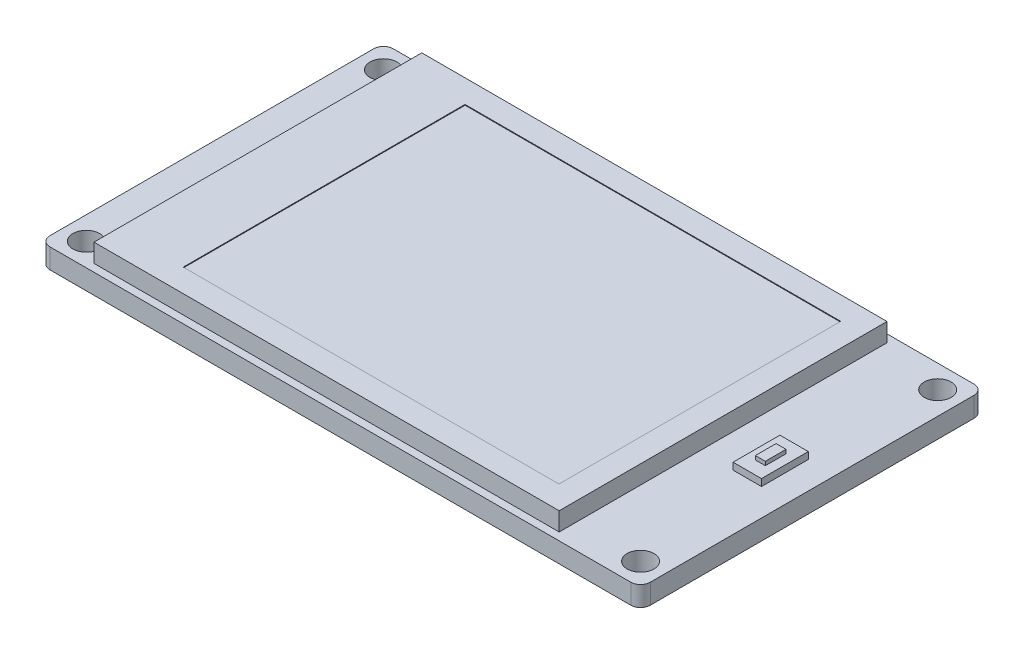
from build123d import *

# Parameters (mm, degrees)
SKETCH_1_R          = 1.75
EXTRUDE_1_DEPTH     = 1.6
SKETCH_1_3_W        = 60.62
SKETCH_1_3_H        = 42.72
SKETCH_1_3_W_2      = 48.96
SKETCH_1_3_H_2      = 36.72
EXTRUDE_2_DEPTH     = 5
EXTRUDE_START       = 1.6
SKETCH_1_4_R        = 1.75
SKETCH_1_4_W        = 60.62
SKETCH_1_4_H        = 42.72
SKETCH_1_4_W_2      = 1.3
SKETCH_1_4_H_2      = 2.7
EXTRUDE_3_DEPTH     = 1
CUT_EXTRUDE_START   = 5
SKETCH_1_5_W        = 48.96
SKETCH_1_5_H        = 36.72
CUT_EXTRUDE_1_DEPTH = 0.1
SKETCH_1_6_W        = 3.7
SKETCH_1_6_H        = 6.1
SKETCH_1_6_W_2      = 1.3
SKETCH_1_6_H_2      = 2.7
EXTRUDE_4_DEPTH     = 3.5
SKETCH_1_7_W        = 1.3
SKETCH_1_7_H        = 2.7
EXTRUDE_5_DEPTH     = 4
SKETCH_2_W          = 0.5
SKETCH_2_H          = 26.5
EXTRUDE_6_DEPTH     = 2


with BuildPart() as part:
    # 草图1 → 凸台-拉伸1 (new body)
    with BuildSketch(Plane(origin=(0, 0, 0), x_dir=(1, 0, 0), z_dir=(0, 1, 0))):
        with BuildLine():
            Line((-37.84, 22.36), (37.84, 22.36))
            ThreePointArc((37.84, 22.36), (38.738025612, 21.988025612), (39.11, 21.09))
            Line((39.11, 21.09), (39.11, -21.09))
            ThreePointArc((39.11, -21.09), (38.738025612, -21.988025612), (37.84, -22.36))
            Line((37.84, -22.36), (-37.84, -22.36))
            ThreePointArc((-37.84, -22.36), (-38.738025612, -21.988025612), (-39.11, -21.09))
            Line((-39.11, -21.09), (-39.11, 21.09))
            ThreePointArc((-39.11, 21.09), (-38.738025612, 21.988025612), (-37.84, 22.36))
        make_face()
        with Locations(Location((-36.11, -19.36, 0), (0, 0, 270))):
            Circle(SKETCH_1_R, mode=Mode.SUBTRACT)
        with Locations(Location((36.11, -19.36, 0), (0, 0, 270))):
            Circle(SKETCH_1_R, mode=Mode.SUBTRACT)
        with Locations(Location((-36.11, 19.36, 0), (0, 0, 270))):
            Circle(SKETCH_1_R, mode=Mode.SUBTRACT)
        with Locations(Location((36.11, 19.36, 0), (0, 0, 270))):
            Circle(SKETCH_1_R, mode=Mode.SUBTRACT)
    extrude(amount=EXTRUDE_1_DEPTH)

    # 草图1<3> → 凸台-拉伸2 (add)
    with BuildSketch(Plane(origin=(0, 0, 0), x_dir=(1, 0, 0), z_dir=(0, 1, 0))):
        with Locations((-2.8, 0)):
            Rectangle(SKETCH_1_3_W, SKETCH_1_3_H)
        Rectangle(SKETCH_1_3_W_2, SKETCH_1_3_H_2)
    extrude(amount=EXTRUDE_2_DEPTH)

    # 草图1<4> → 凸台-拉伸3 (add)
    with BuildSketch(Plane(origin=(0, 0, 0), x_dir=(1, 0, 0), z_dir=(0, 1, 0)).offset(EXTRUDE_START)):
        with BuildLine():
            Line((37.84, 22.36), (-37.84, 22.36))
            ThreePointArc((-37.84, 22.36), (-38.738025612, 21.988025612), (-39.11, 21.09))
            Line((-39.11, 21.09), (-39.11, -21.09))
            ThreePointArc((-39.11, -21.09), (-38.738025612, -21.988025612), (-37.84, -22.36))
            Line((-37.84, -22.36), (37.84, -22.36))
            ThreePointArc((37.84, -22.36), (38.738025612, -21.988025612), (39.11, -21.09))
            Line((39.11, -21.09), (39.11, 21.09))
            ThreePointArc((39.11, 21.09), (38.738025612, 21.988025612), (37.84, 22.36))
        make_face()
        with Locations(Location((-36.11, -19.36, 0), (0, 0, 270))):
            Circle(SKETCH_1_4_R, mode=Mode.SUBTRACT)
        with Locations(Location((36.11, -19.36, 0), (0, 0, 270))):
            Circle(SKETCH_1_4_R, mode=Mode.SUBTRACT)
        with Locations((-2.8, 0)):
            Rectangle(SKETCH_1_4_W, SKETCH_1_4_H, mode=Mode.SUBTRACT)
        with Locations(Location((-36.11, 19.36, 0), (0, 0, 270))):
            Circle(SKETCH_1_4_R, mode=Mode.SUBTRACT)
        with Locations(Location((36.11, 19.36, 0), (0, 0, 270))):
            Circle(SKETCH_1_4_R, mode=Mode.SUBTRACT)
        with Locations((33.71, 0)):
            Rectangle(SKETCH_1_4_W_2, SKETCH_1_4_H_2, mode=Mode.SUBTRACT)
    extrude(amount=EXTRUDE_3_DEPTH)

    # 草图1<5> → 切除-拉伸1 (cut)
    with BuildSketch(Plane(origin=(0, 0, 0), x_dir=(1, 0, 0), z_dir=(0, 1, 0)).offset(CUT_EXTRUDE_START)):
        Rectangle(SKETCH_1_5_W, SKETCH_1_5_H)
    extrude(amount=-CUT_EXTRUDE_1_DEPTH, mode=Mode.SUBTRACT)

    # 草图1<6> → 凸台-拉伸4 (add)
    with BuildSketch(Plane(origin=(0, 0, 0), x_dir=(1, 0, 0), z_dir=(0, 1, 0))):
        with Locations((33.71, 0)):
            Rectangle(SKETCH_1_6_W, SKETCH_1_6_H)
        with Locations((33.71, 0)):
            Rectangle(SKETCH_1_6_W_2, SKETCH_1_6_H_2, mode=Mode.SUBTRACT)
    extrude(amount=EXTRUDE_4_DEPTH)

    # 草图1<7> → 凸台-拉伸5 (add)
    with BuildSketch(Plane(origin=(0, 0, 0), x_dir=(1, 0, 0), z_dir=(0, 1, 0))):
        with Locations((33.71, 0)):
            Rectangle(SKETCH_1_7_W, SKETCH_1_7_H)
    extrude(amount=EXTRUDE_5_DEPTH)


with BuildPart() as body_2:
    # 草图2 → 凸台-拉伸6 (new body)
    with BuildSketch(Plane(origin=(0, 0, 0), x_dir=(1, 0, 0), z_dir=(0, 1, 0))):
        with Locations((-39.36, -0.11)):
            Rectangle(SKETCH_2_W, SKETCH_2_H)
    extrude(amount=-EXTRUDE_6_DEPTH)


solid = Compound([part.part, body_2.part])
